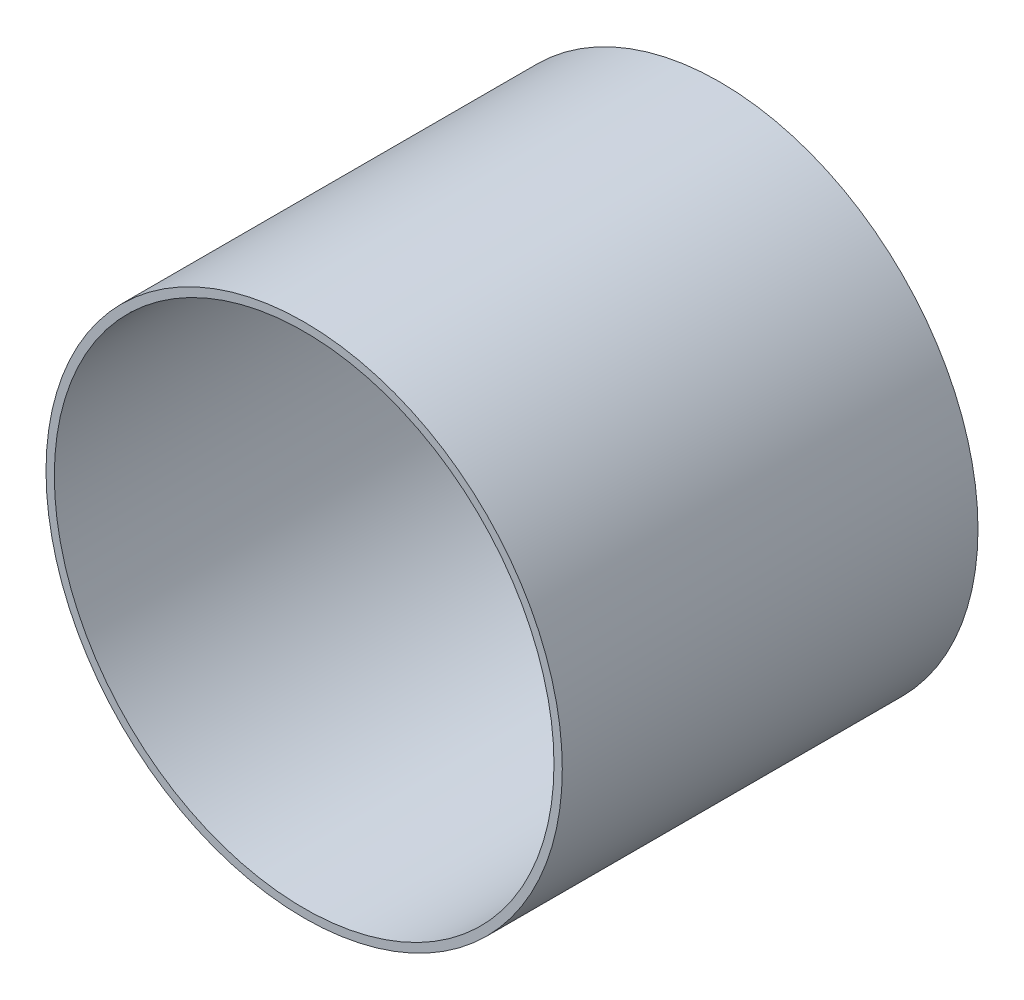
from build123d import *

# Parameters (mm, degrees)
SKETCH_1_R      = 31.05
SKETCH_1_R_2    = 30.05
EXTRUDE_1_DEPTH = 50


with BuildPart() as part:
    # Эскиз1 → Бобышка-Вытянуть1 (new body)
    with BuildSketch(Plane.XY):
        Circle(SKETCH_1_R)
        Circle(SKETCH_1_R_2, mode=Mode.SUBTRACT)
    extrude(amount=EXTRUDE_1_DEPTH)


solid = part.part
